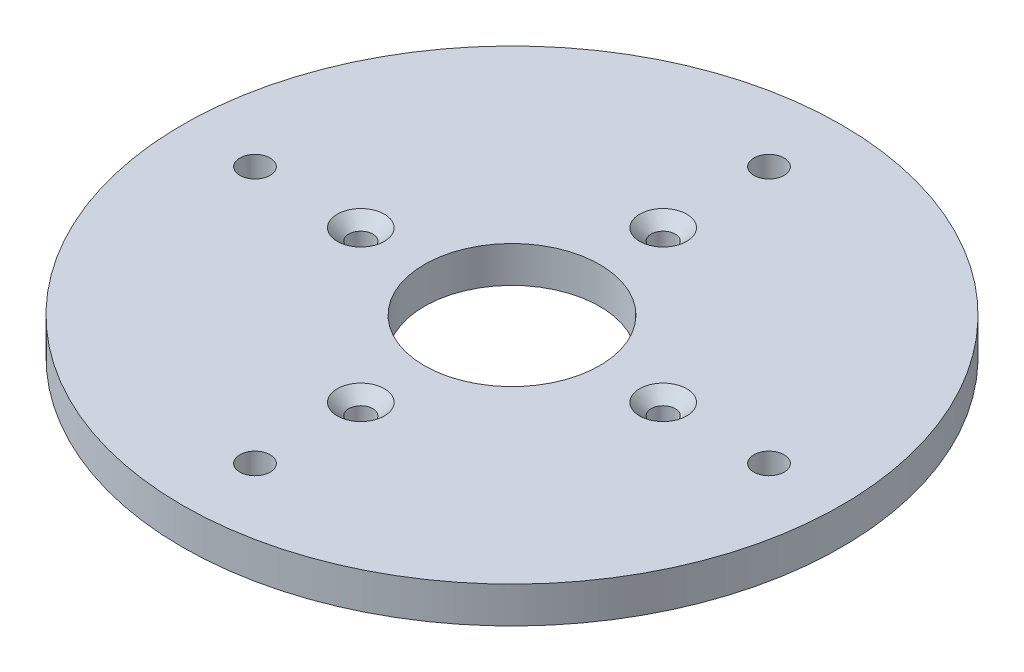
from build123d import *

# Parameters (mm, degrees)
SKETCH_1_R          = 54.5
SKETCH_1_R_2        = 14.5
EXTRUDE_1_DEPTH     = 6
SKETCH_2_R          = 2.5
CUT_EXTRUDE_1_DEPTH = 10
SKETCH_3_R          = 2
CUT_EXTRUDE_2_DEPTH = 10
CHAMFER_1_SIZE      = 1.9


with BuildPart() as part:
    # Эскиз1 → Бобышка-Вытянуть1 (new body)
    with BuildSketch(Plane(origin=(0, 0, 0), x_dir=(1, 0, 0), z_dir=(0, 1, 0))):
        with Locations(Location((0, 0, 0), (0, 0, 270))):
            Circle(SKETCH_1_R)
        with Locations(Location((0, 0, 0), (0, 0, 270))):
            Circle(SKETCH_1_R_2, mode=Mode.SUBTRACT)
    extrude(amount=EXTRUDE_1_DEPTH)

    # Эскиз2 → Вырез-Вытянуть1 (cut)
    with BuildSketch(Plane(origin=(0, 6, 0), x_dir=(1, 0, 0), z_dir=(0, 1, 0))):
        with Locations(Location((0, 42.5, 0), (0, 0, 270))):
            Circle(SKETCH_2_R)
        with Locations(Location((0, -42.5, 0), (0, 0, 270))):
            Circle(SKETCH_2_R)
        with Locations(Location((-42.5, 0, 0), (0, 0, 270))):
            Circle(SKETCH_2_R)
        with Locations(Location((42.5, 0, 0), (0, 0, 270))):
            Circle(SKETCH_2_R)
    extrude(amount=-CUT_EXTRUDE_1_DEPTH, mode=Mode.SUBTRACT)

    # Эскиз3 → Вырез-Вытянуть2 (cut)
    with BuildSketch(Plane(origin=(0, 6, 0), x_dir=(1, 0, 0), z_dir=(0, 1, 0))):
        with Locations(Location((0, 25, 0), (0, 0, 270))):
            Circle(SKETCH_3_R)
        with Locations(Location((-25, 0, 0), (0, 0, 270))):
            Circle(SKETCH_3_R)
        with Locations(Location((0, -25, 0), (0, 0, 270))):
            Circle(SKETCH_3_R)
        with Locations(Location((25, 0, 0), (0, 0, 270))):
            Circle(SKETCH_3_R)
    extrude(amount=-CUT_EXTRUDE_2_DEPTH, mode=Mode.SUBTRACT)

    # Фаска1
    chamfer_1_edges = [part.edges().sort_by_distance(p)[0] for p in [
        (0, 6, -27),
        (-25, 6, -2),
        (0, 6, 23),
        (25, 6, -2),
    ]]
    chamfer(chamfer_1_edges, length=CHAMFER_1_SIZE)


solid = part.part
